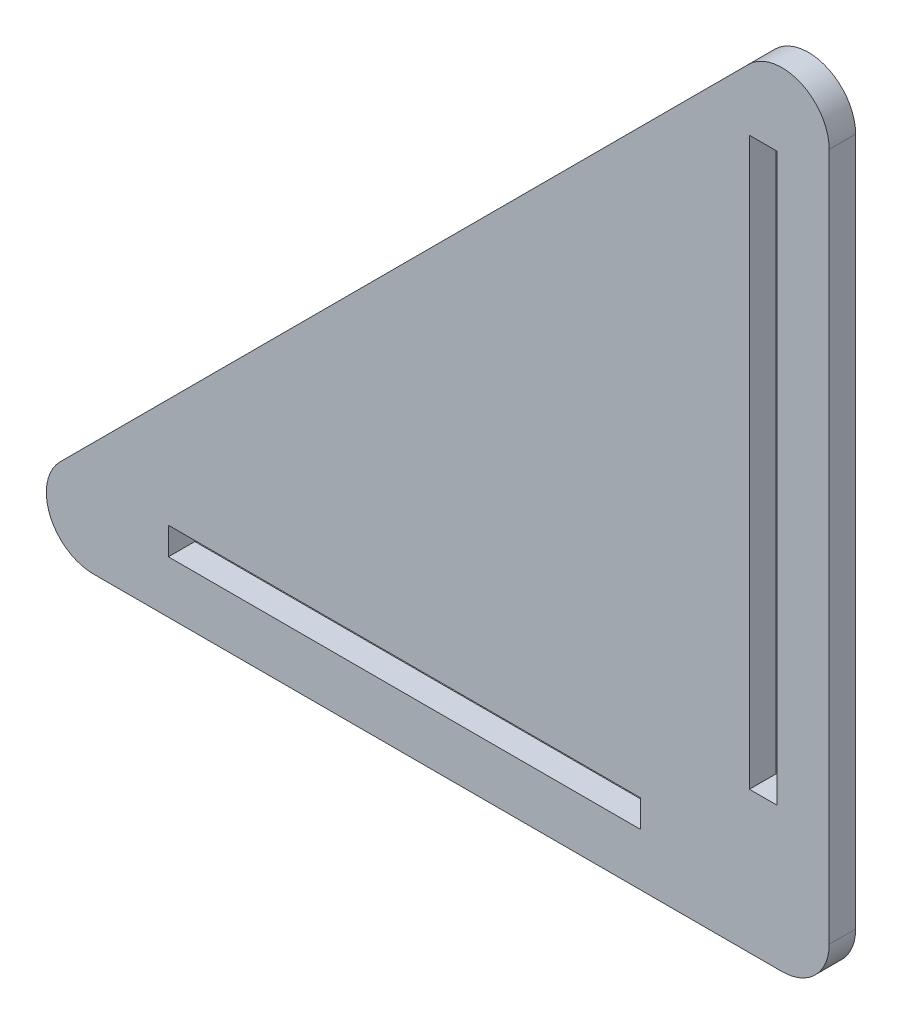
from build123d import *

# Parameters (mm, degrees)
SKETCH_1_W      = 2.9
SKETCH_1_H      = 60
SKETCH_1_W_2    = 50
SKETCH_1_H_2    = 2.9
EXTRUDE_1_DEPTH = 1.4


with BuildPart() as part:
    # Эскиз1 → Бобышка-Вытянуть1 (new, symmetric)
    with BuildSketch(Plane.XY):
        with BuildLine():
            Line((-36.464466094, -36.464466094), (36.464466094, 36.464466094))
            ThreePointArc((36.464466094, 36.464466094), (41.913417162, 37.548329851), (45, 32.928932188))
            Line((45, 32.928932188), (45, -40))
            ThreePointArc((45, -40), (43.535533906, -43.535533906), (40, -45))
            Line((40, -45), (-32.928932188, -45))
            ThreePointArc((-32.928932188, -45), (-37.548329851, -41.913417162), (-36.464466094, -36.464466094))
        make_face()
        with Locations((38, 0)):
            Rectangle(SKETCH_1_W, SKETCH_1_H, mode=Mode.SUBTRACT)
        with Locations((0, -38)):
            Rectangle(SKETCH_1_W_2, SKETCH_1_H_2, mode=Mode.SUBTRACT)
    extrude(amount=EXTRUDE_1_DEPTH, both=True)


solid = part.part
